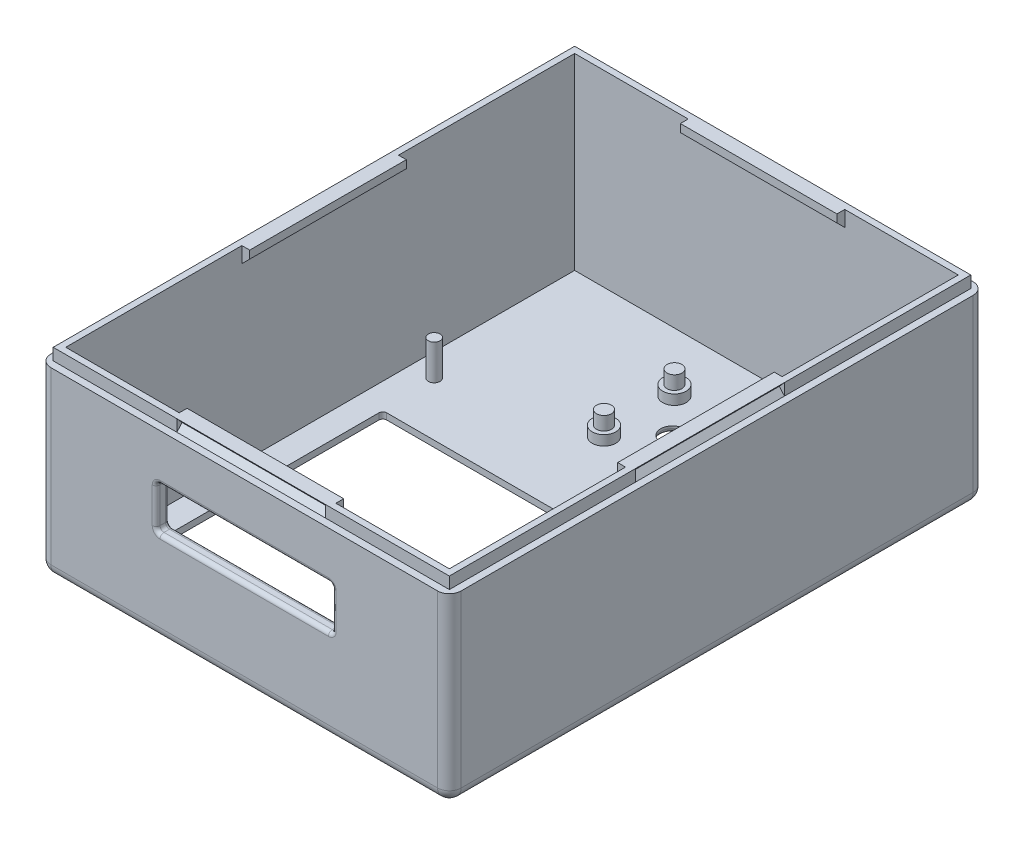
from build123d import *

# Parameters (mm, degrees)
ESQUISSE6_W              = 98
ESQUISSE6_H              = 130
BOSS_EXTRU_4_DEPTH       = 48
COQUE7_T                 = 1.6
EXTRU_MINCE1_DEPTH       = 45
EXTRU_MINCE1_DEPTH_BACK  = 1.6
ESQUISSE7_W              = 104.8
ESQUISSE7_H              = 136.8
ESQUISSE7_W_2            = 98
ESQUISSE7_H_2            = 130
ESQUISSE13_W             = 85
ESQUISSE13_H             = 63.5
ENL_V_MAT_EXTRU_10_DEPTH = 8
ESQUISSE16_R             = 1.5
BOSS_EXTRU_9_DEPTH       = 9
ESQUISSE17_R             = 3
BOSS_EXTRU_10_DEPTH      = 2.54
ESQUISSE17_4_R           = 3
ENL_V_MAT_EXTRU_11_DEPTH = 6
CONG_5_R                 = 3
CONG_6_R                 = 1
ESQUISSE22_W             = 45
ESQUISSE22_H             = 11
ENL_V_MAT_EXTRU_12_DEPTH = 6
CONG_7_R                 = 1
BOSS_EXTRU_15_DEPTH      = 20
BOSS_EXTRU_16_DEPTH      = 20
ENL_V_MAT_EXTRU_14_DEPTH = 19
ENL_V_MAT_EXTRU_15_DEPTH = 19
CONG_8_R                 = 1
ESQUISSE17_7_R           = 1.9
BOSS_EXTRU_18_DEPTH      = 6


with BuildPart() as part:
    # Esquisse6 → Boss.-Extru.4 (new body)
    with BuildSketch(Plane(origin=(0, 0, 0), x_dir=(1, 0, 0), z_dir=(0, 1, 0))):
        Rectangle(ESQUISSE6_W, ESQUISSE6_H)
    extrude(amount=BOSS_EXTRU_4_DEPTH)

    # Coque7
    coque7_openings = [part.faces().sort_by_distance(p)[0] for p in [
        (0, 48, 0),
    ]]
    offset(amount=COQUE7_T, openings=coque7_openings, kind=Kind.INTERSECTION)

    # Esquisse13 → Enlèv. mat.-Extru.10 (cut)
    with BuildSketch(Plane(origin=(0, -1.6, 0), x_dir=(-1, 0, 0), z_dir=(0, -1, 0))):
        with Locations((0, -22.25)):
            Rectangle(ESQUISSE13_W, ESQUISSE13_H)
    extrude(amount=-ENL_V_MAT_EXTRU_10_DEPTH, mode=Mode.SUBTRACT)


with BuildPart() as body_2:
    # Esquisse7 → Extru.-Mince1 (new, two sides: drawn at the far end of the back side and taken through both)
    with BuildSketch(Plane(origin=(0, 0, 0), x_dir=(1, 0, 0), z_dir=(0, 1, 0)).offset(-EXTRU_MINCE1_DEPTH_BACK)):
        Rectangle(ESQUISSE7_W, ESQUISSE7_H)
        Rectangle(ESQUISSE7_W_2, ESQUISSE7_H_2, mode=Mode.SUBTRACT)
    extrude(amount=EXTRU_MINCE1_DEPTH + EXTRU_MINCE1_DEPTH_BACK)


    add(part.part)  # Boss.-Extru.9 merges part
    # Esquisse16 → Boss.-Extru.9 (add)
    with BuildSketch(Plane(origin=(0, 0, 0), x_dir=(1, 0, 0), z_dir=(0, 1, 0))):
        with Locations((43.125, 23.25)):
            Circle(ESQUISSE16_R)
        with Locations((43.125, -61)):
            Circle(ESQUISSE16_R)
        with Locations((-43.125, -61)):
            Circle(ESQUISSE16_R)
        with Locations((-43.125, 23.25)):
            Circle(ESQUISSE16_R)
    extrude(amount=BOSS_EXTRU_9_DEPTH)

    # Esquisse17 → Boss.-Extru.10 (add)
    with BuildSketch(Plane(origin=(0, 0, 0), x_dir=(1, 0, 0), z_dir=(0, 1, 0))):
        with Locations((16.5, 32)):
            Circle(ESQUISSE17_R)
        with Locations((16.5, 50)):
            Circle(ESQUISSE17_R)
        with Locations((-8.5, 50)):
            Circle(ESQUISSE17_R)
        with Locations((-8.5, 32)):
            Circle(ESQUISSE17_R)
    extrude(amount=BOSS_EXTRU_10_DEPTH)

    # Esquisse17<4> → Enlèv. mat.-Extru.11 (cut)
    with BuildSketch(Plane(origin=(0, 0, 0), x_dir=(1, 0, 0), z_dir=(0, 1, 0))):
        with Locations((0, 41)):
            Circle(ESQUISSE17_4_R)
    extrude(amount=-ENL_V_MAT_EXTRU_11_DEPTH, mode=Mode.SUBTRACT)

    # Congé5
    cong_5_edges = [body_2.edges().sort_by_distance(p)[0] for p in [
        (0, -1.6, 68.4),
        (52.4, 21.7, -68.4),
        (52.4, -1.6, 0),
        (0, -1.6, -68.4),
        (-52.4, -1.6, 0),
        (-52.4, 21.7, -68.4),
        (-52.4, 21.7, 68.4),
        (52.4, 21.7, 68.4),
    ]]
    fillet(cong_5_edges, radius=CONG_5_R)

    # Congé6
    cong_6_edges = [body_2.edges().sort_by_distance(p)[0] for p in [
        (-42.5, -0.8, 54),
        (42.5, -0.8, 54),
        (42.5, -0.8, -9.5),
        (-42.5, -0.8, -9.5),
    ]]
    fillet(cong_6_edges, radius=CONG_6_R)

    # Esquisse22 → Enlèv. mat.-Extru.12 (cut)
    with BuildSketch(Plane.XY.offset(68.4)):
        with Locations((0, 27.5)):
            Rectangle(ESQUISSE22_W, ESQUISSE22_H)
    extrude(amount=-ENL_V_MAT_EXTRU_12_DEPTH, mode=Mode.SUBTRACT)

    # Congé7
    cong_7_edges = [body_2.edges().sort_by_distance(p)[0] for p in [
        (-22.5, 27.5, 65),
        (22.5, 27.5, 65),
        (22.5, 27.5, 68.4),
        (-22.5, 27.5, 68.4),
        (-22.5, 33, 66.7),
        (0, 33, 68.4),
        (22.5, 33, 66.7),
        (0, 33, 65),
        (0, 22, 65),
        (22.5, 22, 66.7),
        (0, 22, 68.4),
        (-22.5, 22, 66.7),
    ]]
    fillet(cong_7_edges, radius=CONG_7_R)

    # Esquisse3D2 → Boss.-Extru.15 (add, symmetric)
    with BuildSketch(Plane(origin=(49, 46, 0), x_dir=(-0.7071067811865488, 0.7071067811865464, 0), z_dir=(0, 0, -1))):
        Polygon((0, 0), (-1.414213562, -1.414213562), (1.414213562, -1.414213562), (2.828427125, 0), (1.414213562, 1.414213562), align=None)
    boss_extru_15 = extrude(amount=BOSS_EXTRU_15_DEPTH, both=True)

    # Symétrie1: Boss.-Extru.15 across plane
    add(boss_extru_15.mirror(Plane(origin=(0, 0, 0), x_dir=(0, 0, 1), z_dir=(1, 0, 0))))

    # Esquisse3D4 → Boss.-Extru.16 (add, symmetric)
    with BuildSketch(Plane(origin=(0, 48, -65), x_dir=(0, -1, 0), z_dir=(-1, 0, 0))):
        Polygon((0, 0), (0, 2), (2, 2), (4, 0), (2, 0), align=None)
    boss_extru_16 = extrude(amount=BOSS_EXTRU_16_DEPTH, both=True)

    # Esquisse3D6 → Enlèv. mat.-Extru.14 (cut, symmetric)
    with BuildSketch(Plane(origin=(50.6, 48, 0), x_dir=(0, -1, 0), z_dir=(0, 0, -1))):
        Polygon((0, 0), (3, 0), (1.5, 1.322875656), align=None)
    enl_v_mat_extru_14 = extrude(amount=ENL_V_MAT_EXTRU_14_DEPTH, both=True, mode=Mode.SUBTRACT)

    # Symétrie2: Enlèv. mat.-Extru.14 across plane
    add(enl_v_mat_extru_14.mirror(Plane(origin=(0, 0, 0), x_dir=(0, 0, 1), z_dir=(1, 0, 0))), mode=Mode.SUBTRACT)

    # Symétrie3: Boss.-Extru.16 across plane
    add(boss_extru_16.mirror(Plane.XY))

    # Esquisse3D7 → Enlèv. mat.-Extru.15 (cut, symmetric)
    with BuildSketch(Plane(origin=(0, 48, -66.6), x_dir=(0, -1, 0), z_dir=(-1, 0, 0))):
        Polygon((0, 0), (3, 0), (1.5, 1.322875656), align=None)
    enl_v_mat_extru_15 = extrude(amount=ENL_V_MAT_EXTRU_15_DEPTH, both=True, mode=Mode.SUBTRACT)

    # Symétrie5: Enlèv. mat.-Extru.15 across plane
    add(enl_v_mat_extru_15.mirror(Plane.XY), mode=Mode.SUBTRACT)

    # Congé8
    cong_8_edges = [body_2.edges().sort_by_distance(p)[0] for p in [
        (-3, -1.6, -41),
    ]]
    fillet(cong_8_edges, radius=CONG_8_R)

    # Esquisse17<7> → Boss.-Extru.18 (add)
    with BuildSketch(Plane(origin=(0, 0, 0), x_dir=(1, 0, 0), z_dir=(0, 1, 0))):
        with Locations((16.5, 32)):
            Circle(ESQUISSE17_7_R)
        with Locations((16.5, 50)):
            Circle(ESQUISSE17_7_R)
        with Locations((-8.5, 32)):
            Circle(ESQUISSE17_7_R)
        with Locations((-8.5, 50)):
            Circle(ESQUISSE17_7_R)
    extrude(amount=BOSS_EXTRU_18_DEPTH)


solid = body_2.part
